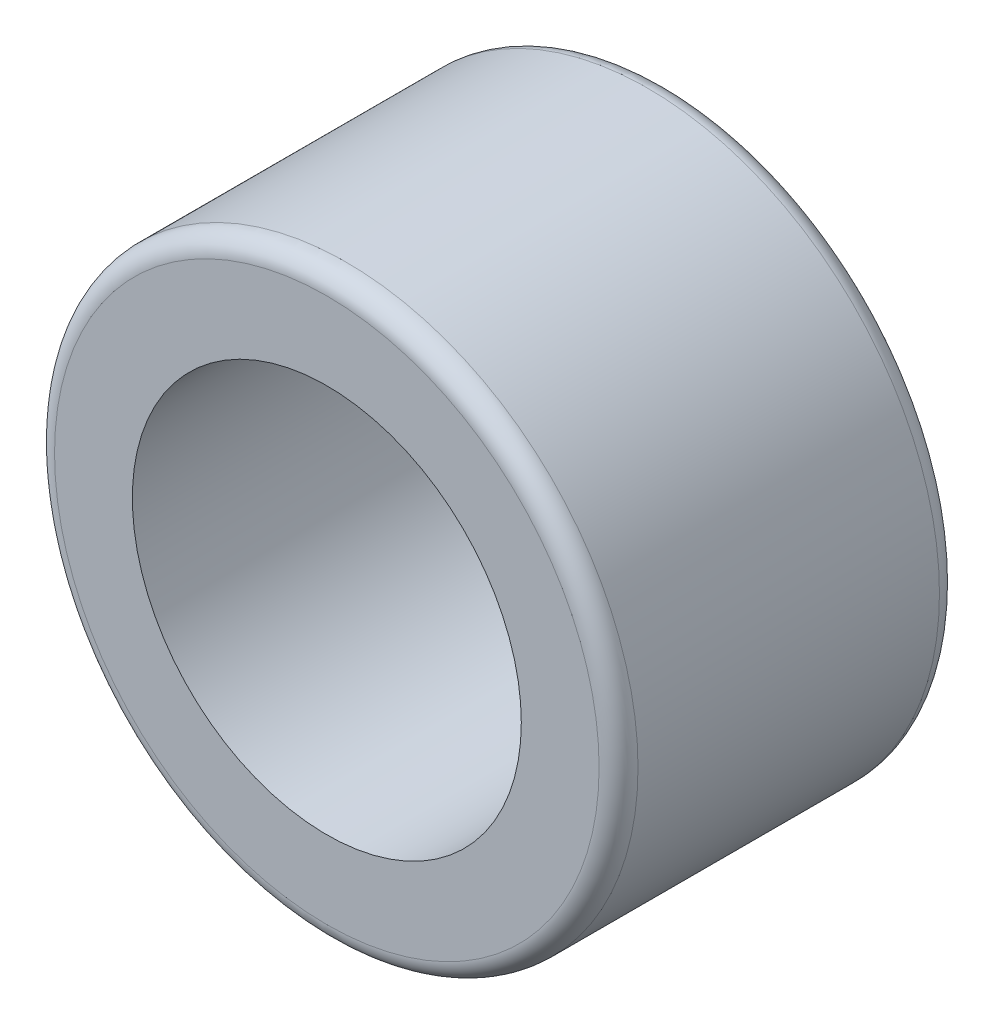
from build123d import *

# Parameters (mm, degrees)
SKETCH_1_R      = 3
SKETCH_1_R_2    = 2
EXTRUDE_1_DEPTH = 3.5
FILLET_1_R      = 0.2


with BuildPart() as part:
    # 草图1 → 凸台-拉伸1 (new body)
    with BuildSketch(Plane.XY):
        Circle(SKETCH_1_R)
        Circle(SKETCH_1_R_2, mode=Mode.SUBTRACT)
    extrude(amount=-EXTRUDE_1_DEPTH)

    # 圆角1
    fillet_1_edges = [part.edges().sort_by_distance(p)[0] for p in [
        (-3, 0, 0),
        (-3, 0, -3.5),
    ]]
    fillet(fillet_1_edges, radius=FILLET_1_R)


solid = part.part
